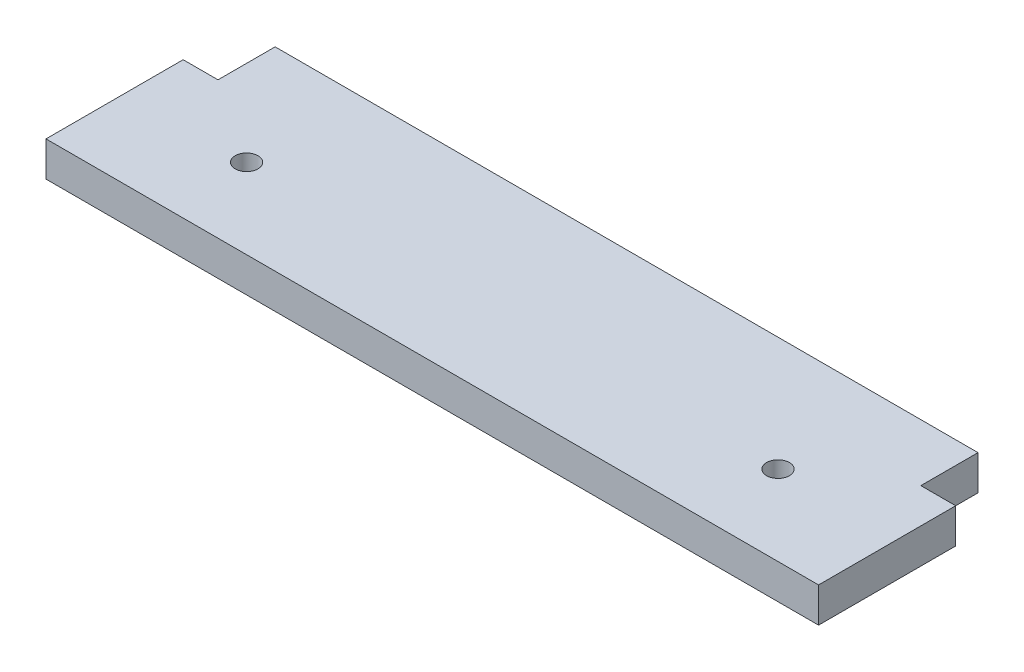
from build123d import *

# Parameters (mm, degrees)
SKETCH1_R           = 1
BOSS_EXTRUDE1_DEPTH = 3.05


with BuildPart() as part:
    # Sketch1 → Boss-Extrude1 (new body)
    with BuildSketch(Plane(origin=(0, 0, 0), x_dir=(1, 0, 0), z_dir=(0, 1, 0))):
        Polygon((0, 0), (67.6, 0), (67.6, 12), (64.55, 12), (64.55, 17), (3.05, 17), (3.05, 12), (0, 12), align=None)
        with Locations(Location((57.05, 7, 0), (0, 0, 270))):
            Circle(SKETCH1_R, mode=Mode.SUBTRACT)
        with Locations(Location((10.55, 7, 0), (0, 0, 270))):
            Circle(SKETCH1_R, mode=Mode.SUBTRACT)
    extrude(amount=BOSS_EXTRUDE1_DEPTH)


solid = part.part
